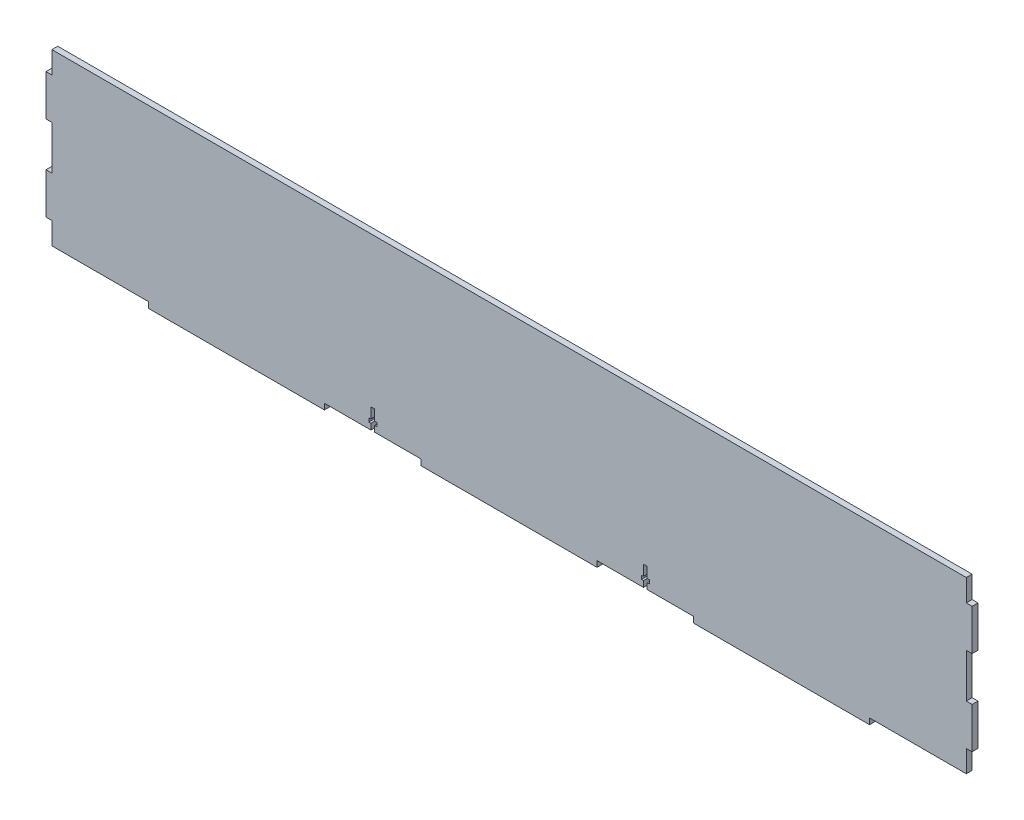
from build123d import *

# Parameters (mm, degrees)
CROQUIS1_W              = 780
CROQUIS1_H              = 145
CROQUIS1_W_2            = 150
CROQUIS1_H_2            = 5
CROQUIS1_W_3            = 5
CROQUIS1_H_3            = 35
SALIENTE_EXTRUIR1_DEPTH = 5
CORTAR_EXTRUIR1_DEPTH   = 10


with BuildPart() as part:
    # Croquis1 → Saliente-Extruir1 (new body)
    with BuildSketch(Plane.XY):
        with Locations((390, 72.5)):
            Rectangle(CROQUIS1_W, CROQUIS1_H)
        with Locations((622.5, -2.5)):
            Rectangle(CROQUIS1_W_2, CROQUIS1_H_2)
        Polygon((390, 0), (315, 0), (315, -5), (465, -5), (465, 0), align=None)
        with Locations((157.5, -2.5)):
            Rectangle(CROQUIS1_W_2, CROQUIS1_H_2)
        with Locations((-2.5, 36.25)):
            Rectangle(CROQUIS1_W_3, CROQUIS1_H_3)
        with Locations((782.5, 36.25)):
            Rectangle(CROQUIS1_W_3, CROQUIS1_H_3)
        with Locations((782.5, 108.75)):
            Rectangle(CROQUIS1_W_3, CROQUIS1_H_3)
        with Locations((-2.5, 108.75)):
            Rectangle(CROQUIS1_W_3, CROQUIS1_H_3)
    extrude(amount=SALIENTE_EXTRUIR1_DEPTH)

    # Croquis2 → Cortar-Extruir1 (cut)
    with BuildSketch(Plane.XY.offset(5)):
        Polygon((275.35, 0), (272.15, 0), (272.15, 5), (270.35, 5), (270.35, 8.2), (272.15, 8.2), (272.15, 17.2), (275.35, 17.2), (275.35, 8.2), (277.15, 8.2), (277.15, 5), (275.35, 5), align=None)
        Polygon((507.85, 8.2), (507.85, 17.2), (504.65, 17.2), (504.65, 8.2), (502.85, 8.2), (502.85, 5), (504.65, 5), (504.65, 0), (507.85, 0), (507.85, 5), (509.65, 5), (509.65, 8.2), align=None)
    extrude(amount=-CORTAR_EXTRUIR1_DEPTH, mode=Mode.SUBTRACT)


solid = part.part
